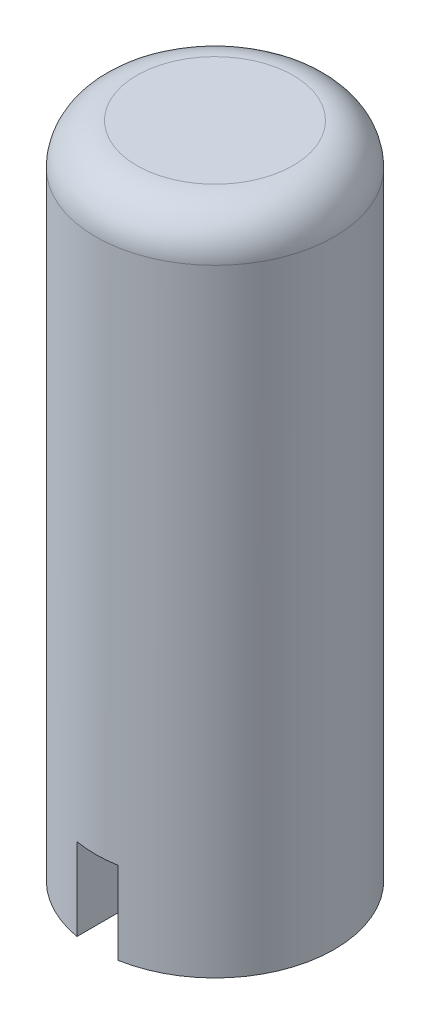
from build123d import *

# Parameters (mm, degrees)
SKETCH1_R           = 2.9
BOSS_EXTRUDE1_DEPTH = 16
FILLET1_R           = 1
SKETCH2_W           = 2.6
SKETCH2_H           = 2.6
CUT_EXTRUDE1_DEPTH  = 2.6
SKETCH3_W           = 1
SKETCH3_H           = 6.114897194
CUT_EXTRUDE2_DEPTH  = 2


with BuildPart() as part:
    # Sketch1 → Boss-Extrude1 (new body)
    with BuildSketch(Plane(origin=(0, 0, 0), x_dir=(1, 0, 0), z_dir=(0, 1, 0))):
        with Locations(Location((0, 0, 0), (0, 0, 270))):
            Circle(SKETCH1_R)
    extrude(amount=BOSS_EXTRUDE1_DEPTH)

    # Fillet1
    fillet1_edges = [part.edges().sort_by_distance(p)[0] for p in [
        (0, 16, -2.9),
    ]]
    fillet(fillet1_edges, radius=FILLET1_R)

    # Sketch2 → Cut-Extrude1 (cut)
    with BuildSketch(Plane.XZ):
        with Locations((-0.7, 0)):
            Rectangle(SKETCH2_W, SKETCH2_H)
    extrude(amount=-CUT_EXTRUDE1_DEPTH, mode=Mode.SUBTRACT)

    # Sketch3 → Cut-Extrude2 (cut)
    with BuildSketch(Plane.XZ):
        Rectangle(SKETCH3_W, SKETCH3_H)
    extrude(amount=-CUT_EXTRUDE2_DEPTH, mode=Mode.SUBTRACT)


solid = part.part
